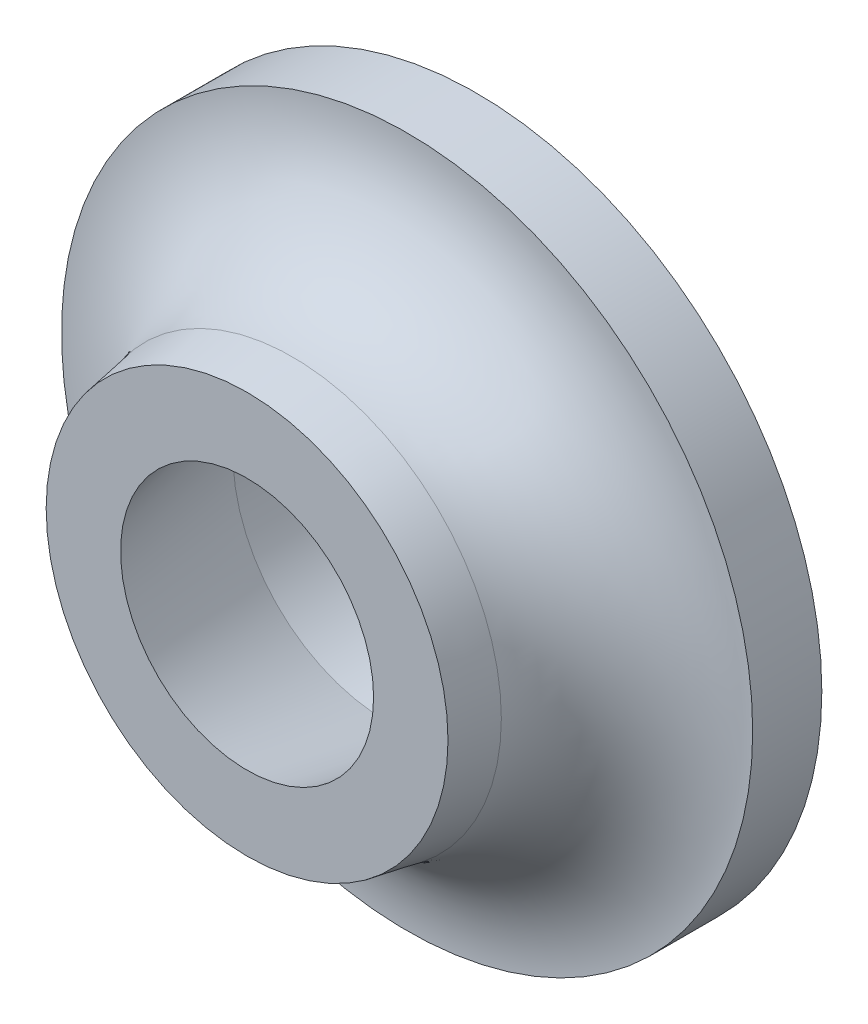
from build123d import *


with BuildPart() as part:
    # Sketch1 → Revolve1 (revolve)
    with BuildSketch(Plane(origin=(0, 0, 0), x_dir=(0, 0, -1), z_dir=(1, 0, 0)), mode=Mode.PRIVATE) as revolve1_sk:
        with BuildLine():
            Line((0.507957169, 14.534494268), (3.788398149, 15.112924521))
            ThreePointArc((3.788398149, 15.112924521), (9.735819432, 18.5466698), (12.084639537, 25))
            Line((12.084639537, 25), (17.084639537, 25))
            Line((17.084639537, 25), (17.084639537, 11.1))
            Line((17.084639537, 11.1), (10.584639537, 11.1))
            Line((10.584639537, 11.1), (0.507957169, 9.151328601))
            Line((0.507957169, 9.151328601), (0.507957169, 14.534494268))
        make_face()
    revolve(revolve1_sk.sketch.rotate(Axis((0, 0, 51.495497957), (0, 0, -1)), 90), axis=Axis((0, 0, 51.495497957), (0, 0, -1)))


solid = part.part
